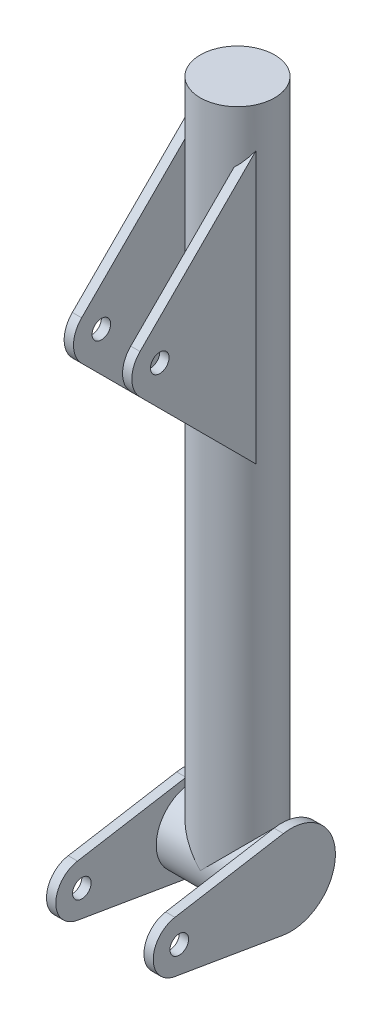
from build123d import *

# Parameters (mm, degrees)
SKETCH1_R           = 12.7
BOSS_EXTRUDE1_DEPTH = 15.0495
BOSS_EXTRUDE2_START = 18.2245
SKETCH1_6_R         = 12.7
SKETCH1_6_R_2       = 3.175
BOSS_EXTRUDE2_DEPTH = 3.175
BOSS_EXTRUDE3_START = 8.382
SKETCH1_8_R         = 3.175
BOSS_EXTRUDE3_DEPTH = 3.175
SKETCH2_R           = 12.7
BOSS_EXTRUDE4_DEPTH = 228.6


with BuildPart() as part:
    # Sketch1 → Boss-Extrude1 (new, symmetric)
    with BuildSketch(Plane.YZ):
        with Locations(Location((0, 0, 0), (0, 0, 90))):
            Circle(SKETCH1_R)
    extrude(amount=BOSS_EXTRUDE1_DEPTH, both=True)

    # Sketch1<6> → Boss-Extrude2 (add)
    # profile 1 of 2: a face of its own
    with BuildSketch(Plane.YZ.offset(BOSS_EXTRUDE2_START)):
        with BuildLine():
            Line((8.765658212, 39.581666667), (15.026842649, 2.54))
            ThreePointArc((15.026842649, 2.54), (0, -15.24), (-15.026842649, 2.54))
            Line((-15.026842649, 2.54), (-8.765658212, 39.581666667))
            ThreePointArc((-8.765658212, 39.581666667), (0, 46.99), (8.765658212, 39.581666667))
        make_face()
        with Locations(Location((0, 0, 0), (0, 0, 90))):
            Circle(SKETCH1_6_R, mode=Mode.SUBTRACT)
        with Locations(Location((0, 38.1, 0), (0, 0, 270))):
            Circle(SKETCH1_6_R_2, mode=Mode.SUBTRACT)
    # profile 2 of 2: a face of its own
    with BuildSketch(Plane.YZ.offset(BOSS_EXTRUDE2_START)):
        with Locations(Location((0, 0, 0), (0, 0, 90))):
            Circle(SKETCH1_6_R)
    extrude(amount=-BOSS_EXTRUDE2_DEPTH)



with BuildPart() as body_2:
    # Sketch1<8> → Boss-Extrude3 (new body)
    with BuildSketch(Plane.YZ.offset(BOSS_EXTRUDE3_START)):
        with BuildLine():
            Line((161.946207909, 44.835192091), (117.111015818, 0))
            Line((117.111015818, 0), (220.251784182, 0))
            Line((220.251784182, 0), (175.416592091, 44.835192091))
            ThreePointArc((175.416592091, 44.835192091), (168.6814, 47.625), (161.946207909, 44.835192091))
        make_face()
        with Locations(Location((168.6814, 38.1, 0), (0, 0, 270))):
            Circle(SKETCH1_8_R, mode=Mode.SUBTRACT)
    extrude(amount=BOSS_EXTRUDE3_DEPTH)


with BuildPart() as part_1:
    add(part.part)

    add(body_2.part)  # Boss-Extrude4 merges body 2
    # Sketch2 → Boss-Extrude4 (add)
    with BuildSketch(Plane(origin=(0, 0, 0), x_dir=(-1, 0, 0), z_dir=(0, 1, 0))):
        with Locations(Location((0, 0, 0), (0, 0, 90))):
            Circle(SKETCH2_R)
    extrude(amount=BOSS_EXTRUDE4_DEPTH)

    # Mirror1: part across plane


with BuildPart() as part_2:
    add(part_1.part)
    add(part_1.part.mirror(Plane(origin=(0, 0, 0), x_dir=(0, 0, 1), z_dir=(1, 0, 0))))


solid = part_2.part
